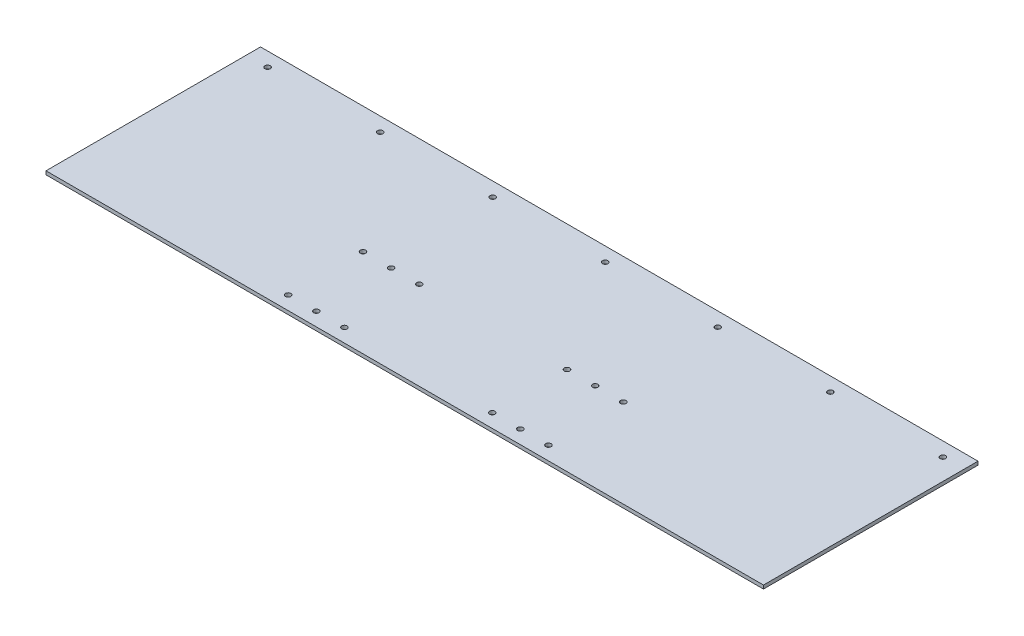
from build123d import *

# Parameters (mm, degrees)
SKETCH1_W           = 647.7
SKETCH1_H           = 193.675
SKETCH1_R           = 2.4257
BOSS_EXTRUDE1_DEPTH = 3.175


with BuildPart() as part:
    # Sketch1 → Boss-Extrude1 (new body)
    with BuildSketch(Plane(origin=(0, 0, 0), x_dir=(1, 0, 0), z_dir=(0, 1, 0))):
        with Locations((323.85, 96.8375)):
            Rectangle(SKETCH1_W, SKETCH1_H)
        with Locations(Location((231.775, 12.2555, 0), (0, 0, 270))):
            Circle(SKETCH1_R, mode=Mode.SUBTRACT)
        with Locations(Location((257.175, 12.2555, 0), (0, 0, 270))):
            Circle(SKETCH1_R, mode=Mode.SUBTRACT)
        with Locations(Location((206.375, 12.2555, 0), (0, 0, 90))):
            Circle(SKETCH1_R, mode=Mode.SUBTRACT)
        with Locations(Location((257.175, 79.8195, 0), (0, 0, 90))):
            Circle(SKETCH1_R, mode=Mode.SUBTRACT)
        with Locations(Location((231.775, 79.8195, 0), (0, 0, 90))):
            Circle(SKETCH1_R, mode=Mode.SUBTRACT)
        with Locations(Location((206.375, 79.8195, 0), (0, 0, 270))):
            Circle(SKETCH1_R, mode=Mode.SUBTRACT)
        with Locations(Location((323.85, 180.975, 0), (0, 0, 270))):
            Circle(SKETCH1_R, mode=Mode.SUBTRACT)
        with Locations(Location((425.45, 180.975, 0), (0, 0, 270))):
            Circle(SKETCH1_R, mode=Mode.SUBTRACT)
        with Locations(Location((527.05, 180.975, 0), (0, 0, 270))):
            Circle(SKETCH1_R, mode=Mode.SUBTRACT)
        with Locations(Location((120.65, 180.975, 0), (0, 0, 90))):
            Circle(SKETCH1_R, mode=Mode.SUBTRACT)
        with Locations(Location((222.25, 180.975, 0), (0, 0, 90))):
            Circle(SKETCH1_R, mode=Mode.SUBTRACT)
        with Locations(Location((628.65, 180.975, 0), (0, 0, 270))):
            Circle(SKETCH1_R, mode=Mode.SUBTRACT)
        with Locations(Location((19.05, 180.975, 0), (0, 0, 90))):
            Circle(SKETCH1_R, mode=Mode.SUBTRACT)
        with Locations(Location((441.325, 79.8195, 0), (0, 0, 90))):
            Circle(SKETCH1_R, mode=Mode.SUBTRACT)
        with Locations(Location((415.925, 79.8195, 0), (0, 0, 270))):
            Circle(SKETCH1_R, mode=Mode.SUBTRACT)
        with Locations(Location((390.525, 79.8195, 0), (0, 0, 270))):
            Circle(SKETCH1_R, mode=Mode.SUBTRACT)
        with Locations(Location((441.325, 12.2555, 0), (0, 0, 270))):
            Circle(SKETCH1_R, mode=Mode.SUBTRACT)
        with Locations(Location((390.525, 12.2555, 0), (0, 0, 90))):
            Circle(SKETCH1_R, mode=Mode.SUBTRACT)
        with Locations(Location((415.925, 12.2555, 0), (0, 0, 90))):
            Circle(SKETCH1_R, mode=Mode.SUBTRACT)
    extrude(amount=BOSS_EXTRUDE1_DEPTH)


solid = part.part
